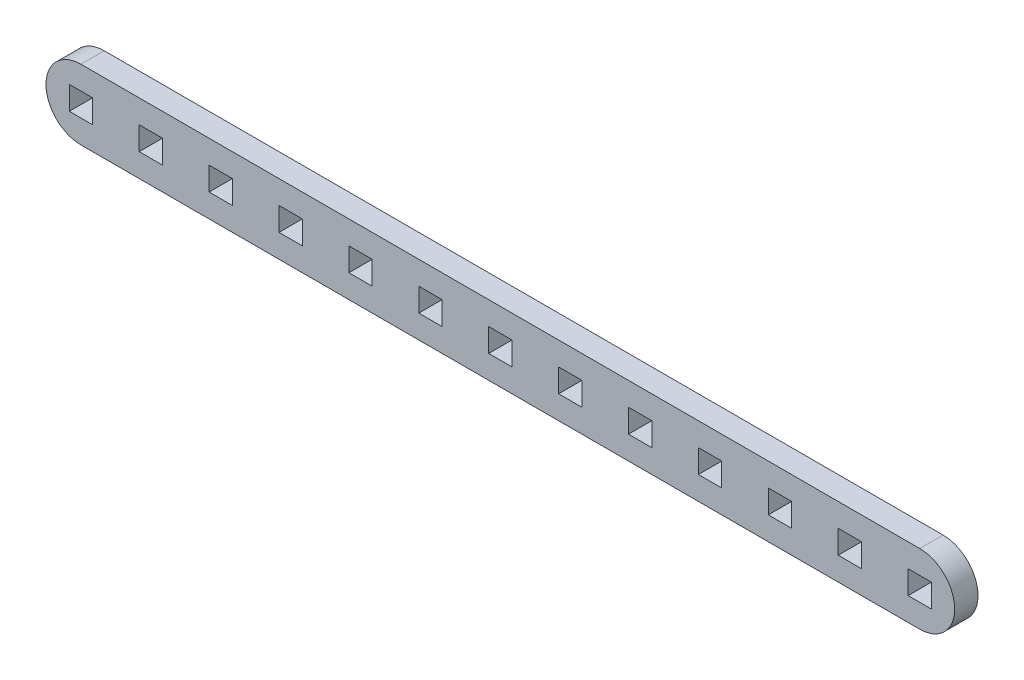
from build123d import *

# Parameters (mm, degrees)
MODEL_W                 = 3
MODEL_H                 = 3
SALIENTE_EXTRUIR1_DEPTH = 3


with BuildPart() as part:
    # Model → Saliente-Extruir1 (new body)
    with BuildSketch(Plane.XY):
        with BuildLine():
            Line((9.904781567, 296.774995526), (117.904781567, 296.774995526))
            ThreePointArc((117.904781567, 296.774995526), (122.404781567, 292.274995526), (117.904781567, 287.774995526))
            Line((117.904781567, 287.774995526), (9.904781567, 287.774995526))
            ThreePointArc((9.904781567, 287.774995526), (5.404781567, 292.274995526), (9.904781567, 296.774995526))
        make_face()
        with Locations((9.904781567, 292.274995526)):
            Rectangle(MODEL_W, MODEL_H, mode=Mode.SUBTRACT)
        with Locations((18.904781567, 292.274995526)):
            Rectangle(MODEL_W, MODEL_H, mode=Mode.SUBTRACT)
        with Locations((27.904781567, 292.274995526)):
            Rectangle(MODEL_W, MODEL_H, mode=Mode.SUBTRACT)
        with Locations((36.904781567, 292.274995526)):
            Rectangle(MODEL_W, MODEL_H, mode=Mode.SUBTRACT)
        with Locations((45.904781567, 292.274995526)):
            Rectangle(MODEL_W, MODEL_H, mode=Mode.SUBTRACT)
        with Locations((54.904781567, 292.274995526)):
            Rectangle(MODEL_W, MODEL_H, mode=Mode.SUBTRACT)
        with Locations((63.904781567, 292.274995526)):
            Rectangle(MODEL_W, MODEL_H, mode=Mode.SUBTRACT)
        with Locations((72.904781567, 292.274995526)):
            Rectangle(MODEL_W, MODEL_H, mode=Mode.SUBTRACT)
        with Locations((81.904781567, 292.274995526)):
            Rectangle(MODEL_W, MODEL_H, mode=Mode.SUBTRACT)
        with Locations((90.904781567, 292.274995526)):
            Rectangle(MODEL_W, MODEL_H, mode=Mode.SUBTRACT)
        with Locations((117.904781567, 292.274995526)):
            Rectangle(MODEL_W, MODEL_H, mode=Mode.SUBTRACT)
        with Locations((99.904781567, 292.274995526)):
            Rectangle(MODEL_W, MODEL_H, mode=Mode.SUBTRACT)
        with Locations((108.904781567, 292.274995526)):
            Rectangle(MODEL_W, MODEL_H, mode=Mode.SUBTRACT)
    extrude(amount=SALIENTE_EXTRUIR1_DEPTH)


solid = part.part
